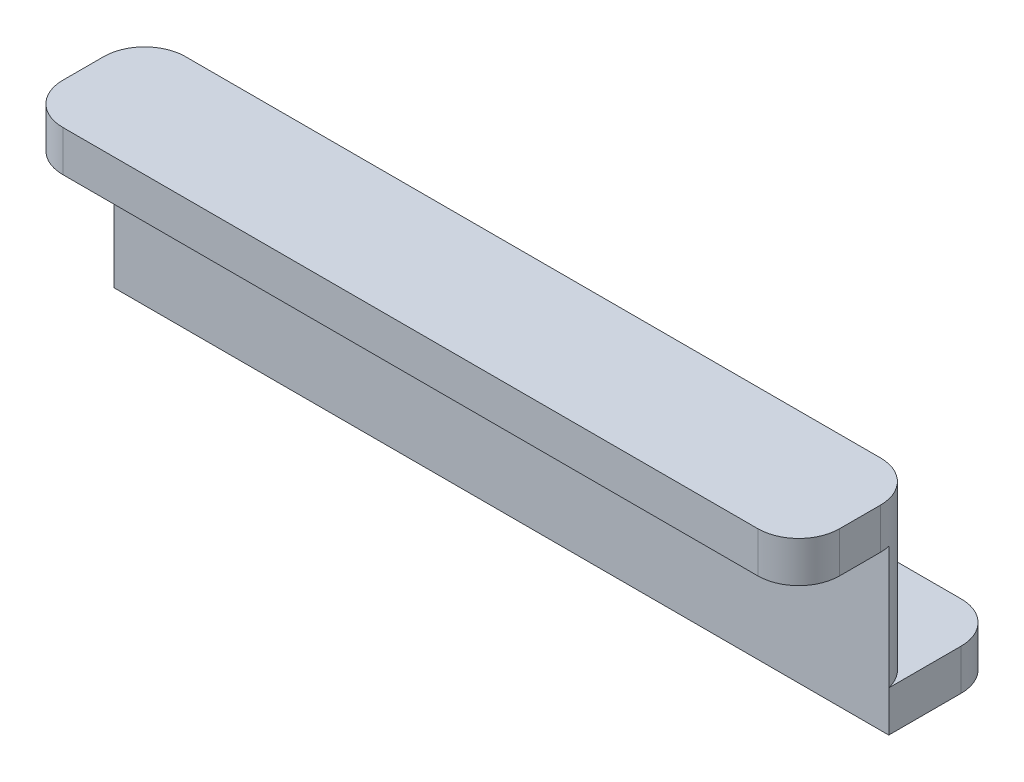
from build123d import *

# Parameters (mm, degrees)
BOSS_EXTRUDE1_DEPTH = 2
BOSS_EXTRUDE2_START = -10
BOSS_EXTRUDE2_DEPTH = 10
BOSS_EXTRUDE3_DEPTH = 2


with BuildPart() as part:
    # Sketch1 → Boss-Extrude1 (new body)
    with BuildSketch(Plane(origin=(0, 0, 0), x_dir=(1, 0, 0), z_dir=(0, 1, 0))):
        with BuildLine():
            Line((-17, -3), (17, -3))
            ThreePointArc((17, -3), (18.414213562, -2.414213562), (19, -1))
            Line((19, -1), (19, 1))
            ThreePointArc((19, 1), (18.414213562, 2.414213562), (17, 3))
            Line((17, 3), (-17, 3))
            ThreePointArc((-17, 3), (-18.414213562, 2.414213562), (-19, 1))
            Line((-19, 1), (-19, -1))
            ThreePointArc((-19, -1), (-18.414213562, -2.414213562), (-17, -3))
        make_face()
    extrude(amount=BOSS_EXTRUDE1_DEPTH)

    # Sketch2 → Boss-Extrude2 (add)
    with BuildSketch(Plane(origin=(0, 2, 0), x_dir=(1, 0, 0), z_dir=(0, 1, 0)).offset(BOSS_EXTRUDE2_START)):
        with BuildLine():
            Line((17, 3), (-17, 3))
            ThreePointArc((-17, 3), (-18.241842888, 2.567745592), (-18.946893714, 1.457826241))
            Line((-18.946893714, 1.457826241), (18.946893714, 1.457826241))
            ThreePointArc((18.946893714, 1.457826241), (18.241842888, 2.567745592), (17, 3))
        make_face()
    extrude(amount=BOSS_EXTRUDE2_DEPTH)

    # Sketch4 → Boss-Extrude3 (add)
    with BuildSketch(Plane.XZ.offset(8)):
        with BuildLine():
            Line((-18.946893714, -1.457826241), (-18.946893714, -5))
            ThreePointArc((-18.946893714, -5), (-18.361107276, -6.414213562), (-16.946893714, -7))
            Line((-16.946893714, -7), (16.946893714, -7))
            ThreePointArc((16.946893714, -7), (18.361107276, -6.414213562), (18.946893714, -5))
            Line((18.946893714, -5), (18.946893714, -1.457826241))
            ThreePointArc((18.946893714, -1.457826241), (18.241842888, -2.567745592), (17, -3))
            Line((17, -3), (-17, -3))
            ThreePointArc((-17, -3), (-18.241842888, -2.567745592), (-18.946893714, -1.457826241))
        make_face()
    extrude(amount=-BOSS_EXTRUDE3_DEPTH)


solid = part.part
